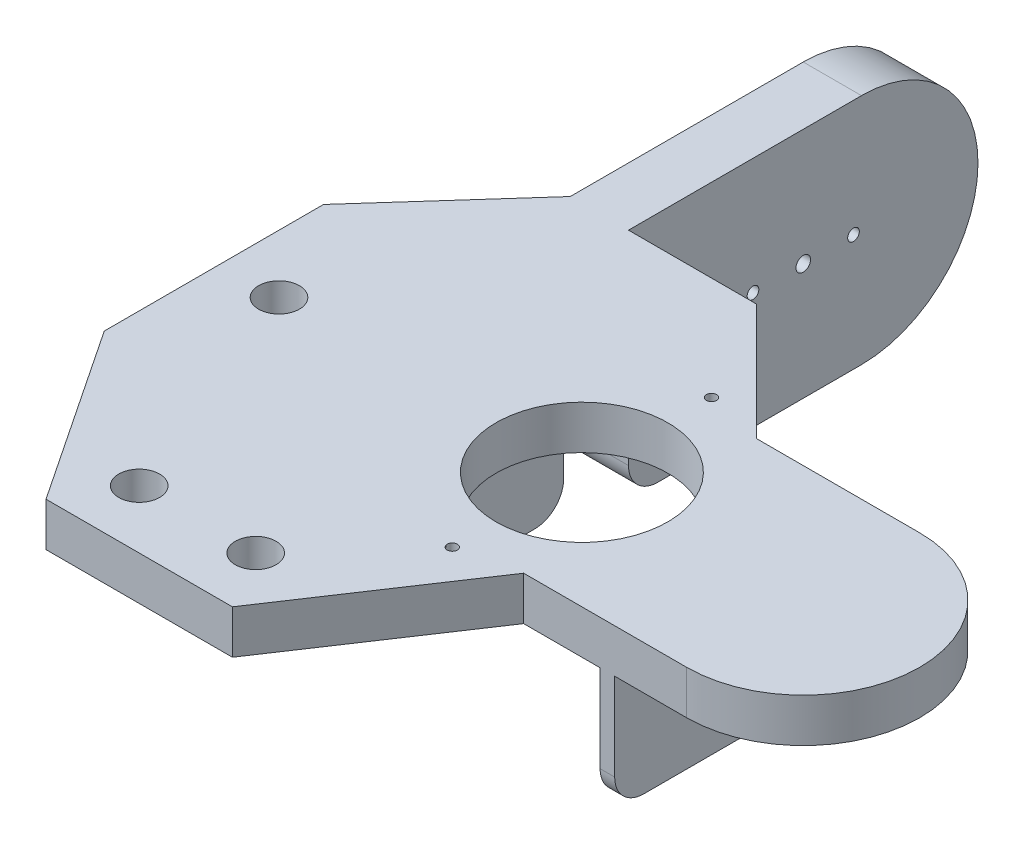
from build123d import *

# Parameters (mm, degrees)
SKETCH_1_R          = 7
EXTRUDE_1_DEPTH     = 15
SKETCH_2_W          = 20
SKETCH_2_H          = 80
EXTRUDE_3_DEPTH     = 120
SKETCH_3_R          = 2.5
SKETCH_3_R_2        = 2
CUT_EXTRUDE_1_DEPTH = 120
SKETCH_4_W          = 102.5
SKETCH_4_H          = 80
EXTRUDE_4_DEPTH     = 40
SKETCH_5_W          = 92.5
SKETCH_5_H          = 80
CUT_EXTRUDE_2_DEPTH = 40
FILLET_1_R          = 10
FILLET_2_RADIUS     = 40
FILLET_2_LENGTH     = 20
FILLET_3_R          = 10
SKETCH_6_R          = 1.75
CUT_EXTRUDE_4_DEPTH = 40
FILLET_5_RADIUS     = 40
FILLET_5_LENGTH     = 15


with BuildPart() as part:
    # 草图1 → 凸台-拉伸1 (new body)
    # profile 1 of 2: a face of its own
    with BuildSketch(Plane(origin=(0, 0, 0), x_dir=(1, 0, 0), z_dir=(0, 1, 0))):
        with BuildLine():
            Line((13, 100), (0, 100))
            Line((0, 100), (0, 60))
            Line((0, 60), (40, 0))
            Line((40, 0), (104, 0))
            Line((104, 0), (144, 60))
            Line((144, 60), (240, 60))
            Line((240, 60), (240, 100))
            Line((240, 100), (153.5, 100))
            ThreePointArc((153.5, 100), (124, 70.5), (94.5, 100))
            Line((94.5, 100), (27, 100))
            ThreePointArc((27, 100), (20, 93), (13, 100))
        make_face()
        with Locations(Location((52, 20, 0), (0, 0, 270))):
            Circle(SKETCH_1_R, mode=Mode.SUBTRACT)
        with Locations(Location((92, 20, 0), (0, 0, 270))):
            Circle(SKETCH_1_R, mode=Mode.SUBTRACT)
    # profile 2 of 2: a face of its own
    with BuildSketch(Plane(origin=(0, 0, 0), x_dir=(1, 0, 0), z_dir=(0, 1, 0))):
        with BuildLine():
            Line((104, 180), (40, 180))
            Line((40, 180), (0, 135.27864045))
            Line((0, 135.27864045), (0, 100))
            Line((0, 100), (13, 100))
            ThreePointArc((13, 100), (20, 107), (27, 100))
            Line((27, 100), (94.5, 100))
            ThreePointArc((94.5, 100), (124, 129.5), (153.5, 100))
            Line((153.5, 100), (240, 100))
            Line((240, 100), (240, 140))
            Line((240, 140), (144, 140))
            Line((144, 140), (104, 180))
        make_face()
    extrude(amount=EXTRUDE_1_DEPTH)

    # 草图2 → 凸台-拉伸3 (add)
    with BuildSketch(Plane(origin=(0, 0, -180), x_dir=(-1, 0, 0), z_dir=(0, 0, -1))):
        with Locations((-50, -25)):
            Rectangle(SKETCH_2_W, SKETCH_2_H)
    extrude(amount=EXTRUDE_3_DEPTH)

    # 草图3 → 切除-拉伸1 (cut)
    with BuildSketch(Plane(origin=(60, 0, 0), x_dir=(0, 0, -1), z_dir=(1, 0, 0))):
        with Locations(Location((240, -25, 0), (0, 0, 90))):
            Circle(SKETCH_3_R)
        with Locations(Location((257.25, -25, 0), (0, 0, 90))):
            Circle(SKETCH_3_R_2)
        with Locations(Location((222.75, -25, 0), (0, 0, 90))):
            Circle(SKETCH_3_R_2)
    extrude(amount=-CUT_EXTRUDE_1_DEPTH, mode=Mode.SUBTRACT)

    # 草图4 → 凸台-拉伸4 (add)
    with BuildSketch(Plane.XZ):
        with Locations((124, -100)):
            Rectangle(SKETCH_4_W, SKETCH_4_H)
    extrude(amount=EXTRUDE_4_DEPTH)

    # 草图5 → 切除-拉伸2 (cut)
    with BuildSketch(Plane.XZ.offset(40)):
        with Locations((124, -100)):
            Rectangle(SKETCH_5_W, SKETCH_5_H)
    extrude(amount=-CUT_EXTRUDE_2_DEPTH, mode=Mode.SUBTRACT)

    # 圆角1
    fillet_1_edges = [part.edges().sort_by_distance(p)[0] for p in [
        (172.75, -40, -140),
        (172.75, -40, -60),
        (75.25, -40, -140),
        (75.25, -40, -60),
    ]]
    fillet(fillet_1_edges, radius=FILLET_1_R)

    # 圆角2: full round fillet: the end face becomes a half cylinder, R = half its width
    fillet_2_face = Plane((50, -25, -300), x_dir=(1, 0, 0), z_dir=(0, 0, -1))  # on the end face: x along it, z out of the body
    fillet_2_slab = fillet_2_face.offset(-FILLET_2_RADIUS / 2) * Box(FILLET_2_LENGTH, 2 * FILLET_2_RADIUS, FILLET_2_RADIUS, mode=Mode.PRIVATE)  # the body's end, R deep
    fillet_2_round = Plane((50, -25, -260), x_dir=(0, 0, -1), z_dir=(1, 0, 0)) * Cylinder(FILLET_2_RADIUS, FILLET_2_LENGTH, mode=Mode.PRIVATE)  # its axis R under the face
    add(fillet_2_slab - fillet_2_round, mode=Mode.SUBTRACT)

    # 圆角3
    fillet_3_edges = [part.edges().sort_by_distance(p)[0] for p in [
        (50, -65, -180),
    ]]
    fillet(fillet_3_edges, radius=FILLET_3_R)

    # 草图6 → 切除-拉伸4 (cut)
    with BuildSketch(Plane(origin=(0, 15, 0), x_dir=(1, 0, 0), z_dir=(0, 1, 0))):
        with Locations(Location((124, 144.5, 0), (0, 0, 270))):
            Circle(SKETCH_6_R)
        with Locations(Location((124, 55.5, 0), (0, 0, 270))):
            Circle(SKETCH_6_R)
    extrude(amount=-CUT_EXTRUDE_4_DEPTH, mode=Mode.SUBTRACT)

    # 圆角5: full round fillet: the end face becomes a half cylinder, R = half its width
    fillet_5_face = Plane((240, 7.5, -100), x_dir=(0, -1, 0), z_dir=(1, 0, 0))  # on the end face: x along it, z out of the body
    fillet_5_slab = fillet_5_face.offset(-FILLET_5_RADIUS / 2) * Box(FILLET_5_LENGTH, 2 * FILLET_5_RADIUS, FILLET_5_RADIUS, mode=Mode.PRIVATE)  # the body's end, R deep
    fillet_5_round = Plane((200, 7.5, -100), x_dir=(1, 0, 0), z_dir=(0, -1, 0)) * Cylinder(FILLET_5_RADIUS, FILLET_5_LENGTH, mode=Mode.PRIVATE)  # its axis R under the face
    add(fillet_5_slab - fillet_5_round, mode=Mode.SUBTRACT)


solid = part.part
